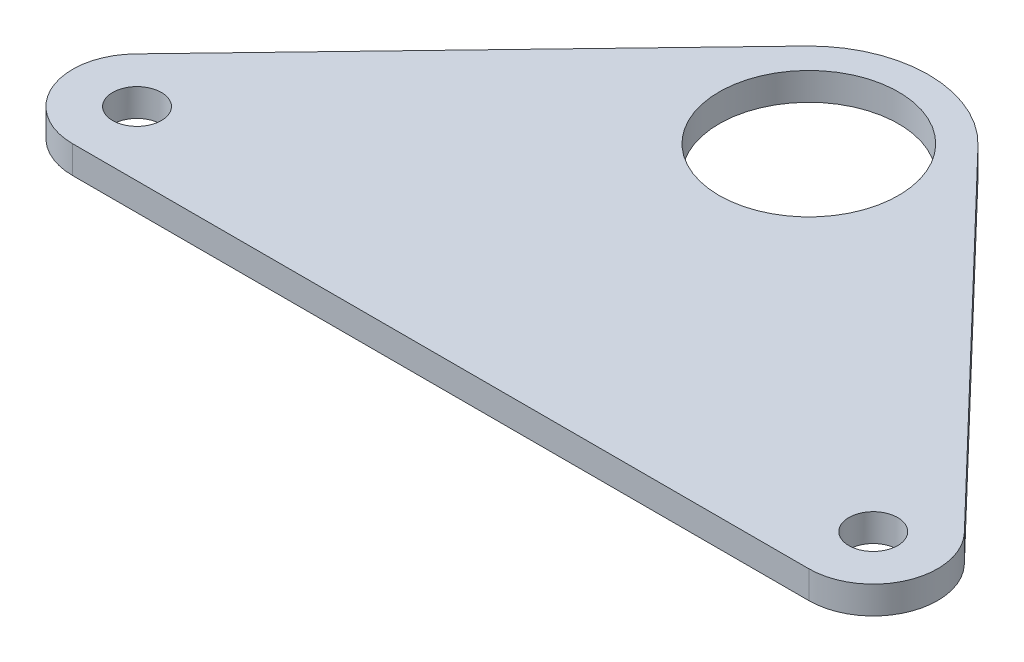
from build123d import *

# Parameters (mm, degrees)
SKETCH1_R            = 9.75
BOSS_EXTRUDE1_DEPTH  = 3
M5_CLEARANCE_HOLE1_D = 5.3


with BuildPart() as part:
    # Sketch1 → Boss-Extrude1 (new body)
    with BuildSketch(Plane(origin=(0, 0, 0), x_dir=(1, 0, 0), z_dir=(0, 1, 0))):
        with BuildLine():
            Line((-9.377695636, 9.003267438), (-45.049528419, -28.152086764))
            ThreePointArc((-45.049528419, -28.152086764), (-46.439541624, -35.744504268), (-40, -40))
            Line((-40, -40), (40, -40))
            ThreePointArc((40, -40), (46.439541624, -35.744504268), (45.049528419, -28.152086764))
            Line((45.049528419, -28.152086764), (9.377695636, 9.003267438))
            ThreePointArc((9.377695636, 9.003267438), (0, 13), (-9.377695636, 9.003267438))
        make_face()
        with Locations(Location((0, 0, 0), (0, 0, 270))):
            Circle(SKETCH1_R, mode=Mode.SUBTRACT)
    extrude(amount=BOSS_EXTRUDE1_DEPTH)

    # M5 Clearance Hole1 (through all)
    with Locations(Plane(origin=(0, 3, 0), x_dir=(1, 0, 0), z_dir=(0, 1, 0))):
        with Locations((-40, -33), (40, -33)):
            Hole(M5_CLEARANCE_HOLE1_D / 2)


solid = part.part
